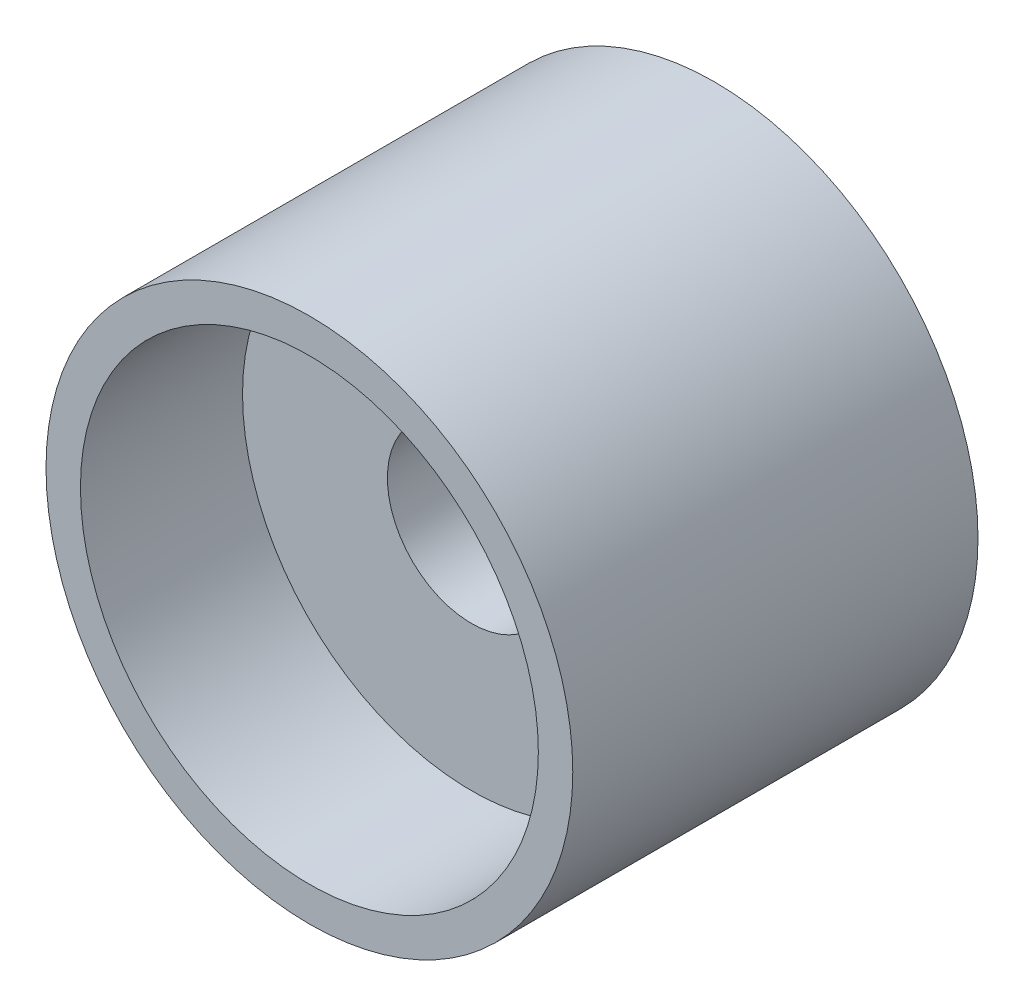
from build123d import *

# Parameters (mm, degrees)
SKETCH1_R           = 13
SKETCH1_R_2         = 4.15
BOSS_EXTRUDE1_DEPTH = 20
SKETCH2_R           = 11.3
CUT_EXTRUDE1_DEPTH  = 8


with BuildPart() as part:
    # Sketch1 → Boss-Extrude1 (new body)
    with BuildSketch(Plane.XY):
        Circle(SKETCH1_R)
        Circle(SKETCH1_R_2, mode=Mode.SUBTRACT)
    extrude(amount=BOSS_EXTRUDE1_DEPTH)

    # Sketch2 → Cut-Extrude1 (cut)
    with BuildSketch(Plane.XY.offset(20)):
        Circle(SKETCH2_R)
    extrude(amount=-CUT_EXTRUDE1_DEPTH, mode=Mode.SUBTRACT)


solid = part.part
